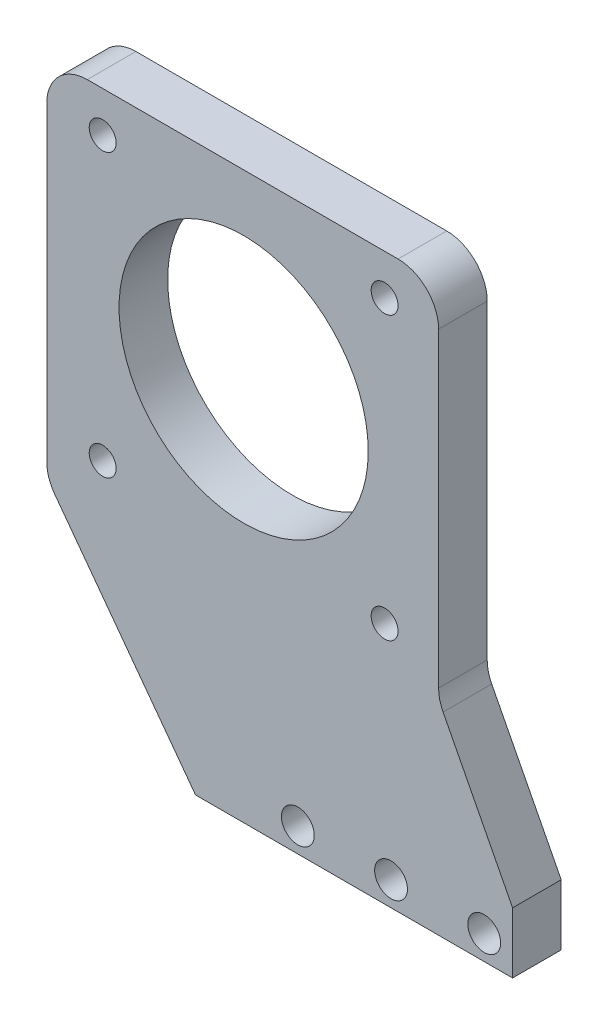
from build123d import *

# Parameters (mm, degrees)
SKETCH1_R           = 30.75
SKETCH1_R_2         = 3.325
BOSS_EXTRUDE1_DEPTH = 6
SKETCH2_R           = 4.05
CUT_EXTRUDE1_DEPTH  = 161.436981194
LPATTERN1_COUNT     = 3
LPATTERN1_PITCH     = 23


with BuildPart() as part:
    # Sketch1 → Boss-Extrude1 (new, symmetric)
    with BuildSketch(Plane.XY):
        with BuildLine():
            Line((-34.748577527, 46.893721429), (0, 0))
            Line((0, 0), (78.24898238, 0))
            Line((78.24898238, 0), (78.24898238, 15))
            Line((78.24898238, 15), (61.096720235, 48.264425218))
            ThreePointArc((61.096720235, 48.264425218), (60.266695593, 50.489412932), (59.984720032, 52.847378372))
            Line((59.984720032, 52.847378372), (59.984720032, 129.546127467))
            ThreePointArc((59.984720032, 129.546127467), (57.055787843, 136.617195279), (49.984720032, 139.546127467))
            Line((49.984720032, 139.546127467), (-26.714029064, 139.546127467))
            ThreePointArc((-26.714029064, 139.546127467), (-33.785096876, 136.617195279), (-36.714029064, 129.546127467))
            Line((-36.714029064, 129.546127467), (-36.714029064, 52.847378372))
            ThreePointArc((-36.714029064, 52.847378372), (-36.209961999, 49.712532653), (-34.748577527, 46.893721429))
        make_face()
        with Locations((11.87148929, 94.76591255)):
            Circle(SKETCH1_R, mode=Mode.SUBTRACT)
        with Locations((46.66148929, 129.55591255)):
            Circle(SKETCH1_R_2, mode=Mode.SUBTRACT)
        with Locations((46.66148929, 59.97591255)):
            Circle(SKETCH1_R_2, mode=Mode.SUBTRACT)
        with Locations((-22.91851071, 59.97591255)):
            Circle(SKETCH1_R_2, mode=Mode.SUBTRACT)
        with Locations((-22.91851071, 129.55591255)):
            Circle(SKETCH1_R_2, mode=Mode.SUBTRACT)
    extrude(amount=BOSS_EXTRUDE1_DEPTH, both=True)

    # Sketch2 → Cut-Extrude1 (cut, through all)
    with BuildSketch(Plane.XY.offset(6)):
        with Locations((71.24898238, 6)):
            Circle(SKETCH2_R)
    cut_extrude1 = extrude(amount=-CUT_EXTRUDE1_DEPTH, mode=Mode.SUBTRACT)

    # LPattern1: Cut-Extrude1 ×3
    with Locations(*[(-i * LPATTERN1_PITCH, 0, 0) for i in range(1, LPATTERN1_COUNT)]):
        add(cut_extrude1, mode=Mode.SUBTRACT)


solid = part.part
